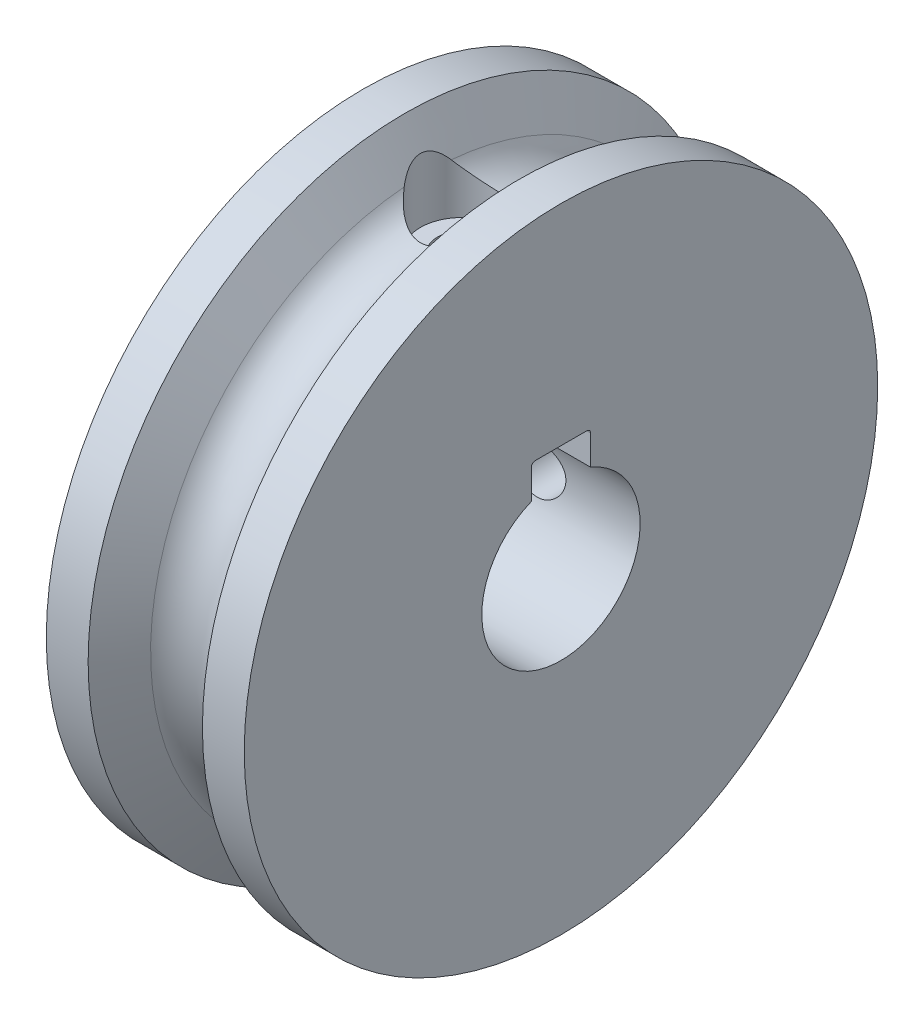
from build123d import *

# Parameters (mm, degrees)
SKETCH1_W           = 10
SKETCH1_H           = 12
SKETCH2_W           = 2.1
SKETCH2_H           = 4.6
TAPPED_HOLE1_REACH  = 38.29
TAPPED_HOLE1_BORE_R = 1.25
CIRPATTERN1_COUNT   = 2
CIRPATTERN1_ANGLE   = 90
CUT_EXTRUDE1_DEPTH  = 25.738633924


with BuildPart() as part:
    # Sketch1 → Revolve1 (revolve)
    with BuildSketch(Plane.XY, mode=Mode.PRIVATE) as revolve1_sk:
        with Locations((5, 10)):
            Rectangle(SKETCH1_W, SKETCH1_H)
    revolve(revolve1_sk.sketch.rotate(Axis((0, 0, 0), (1, 0, 0)), 180), axis=Axis((0, 0, 0), (1, 0, 0)))

    # Sketch2 → Cut-Revolve1 (revolve, cut)
    with BuildSketch(Plane.XY, mode=Mode.PRIVATE) as cut_revolve1_sk:
        with Locations((6.05, 13.7)):
            Rectangle(SKETCH2_W, SKETCH2_H)
    cut_revolve1 = revolve(cut_revolve1_sk.sketch.rotate(Axis((5, 16, 0), (0, -1, 0)), 180), axis=Axis((5, 16, 0), (0, -1, 0)), mode=Mode.SUBTRACT)

    # Tapped Hole1 bore → Tapped Hole1 (cut, up to next)
    with BuildSketch(Plane(origin=(0, 15, 0), x_dir=(1, 0, 0), z_dir=(0, 1, 0)), mode=Mode.PRIVATE) as tapped_hole1_sk1:
        with Locations((5, 0)):
            Circle(TAPPED_HOLE1_BORE_R)
    tapped_hole1_tool1 = extrude(tapped_hole1_sk1.sketch, amount=-TAPPED_HOLE1_REACH, mode=Mode.PRIVATE) & part.part
    tapped_hole1 = tapped_hole1_tool1.solids().sort_by_distance((5, 15, 0))[0]
    add(tapped_hole1, mode=Mode.SUBTRACT)

    # CirPattern1: Cut-Revolve1, Tapped Hole1 ×2 about axis
    cirpattern1_axis = Axis((0, 0, 0), (-1, 0, 0))
    add([cut_revolve1.rotate(cirpattern1_axis, i * CIRPATTERN1_ANGLE / (CIRPATTERN1_COUNT - 1)) for i in range(1, CIRPATTERN1_COUNT)], mode=Mode.SUBTRACT)
    add([tapped_hole1.rotate(cirpattern1_axis, i * CIRPATTERN1_ANGLE / (CIRPATTERN1_COUNT - 1)) for i in range(1, CIRPATTERN1_COUNT)], mode=Mode.SUBTRACT)

    # Sketch5 → Cut-Extrude1 (cut, through all)
    with BuildSketch(Plane(origin=(0, 0, 0), x_dir=(0, 0, -1), z_dir=(1, 0, 0))):
        with BuildLine():
            Line((-1.5, 0), (1.5, 0))
            Line((1.5, 0), (1.5, 5.2))
            ThreePointArc((1.5, 5.2), (1.441421356, 5.341421356), (1.3, 5.4))
            Line((1.3, 5.4), (-1.3, 5.4))
            ThreePointArc((-1.3, 5.4), (-1.441421356, 5.341421356), (-1.5, 5.2))
            Line((-1.5, 5.2), (-1.5, 0))
        make_face()
    extrude(amount=CUT_EXTRUDE1_DEPTH, mode=Mode.SUBTRACT)

    # Sketch7 → Cut-Revolve3 (revolve, cut)
    with BuildSketch(Plane.XY, mode=Mode.PRIVATE) as cut_revolve3_sk:
        with BuildLine():
            Line((2.113248654, 16), (3.267949192, 14))
            ThreePointArc((3.267949192, 14), (5, 13), (6.732050808, 14))
            Line((6.732050808, 14), (7.886751346, 16))
            Line((7.886751346, 16), (2.113248654, 16))
        make_face()
    revolve(cut_revolve3_sk.sketch.rotate(Axis((0, 0, 0), (1, 0, 0)), 180), axis=Axis((0, 0, 0), (1, 0, 0)), mode=Mode.SUBTRACT)


solid = part.part
